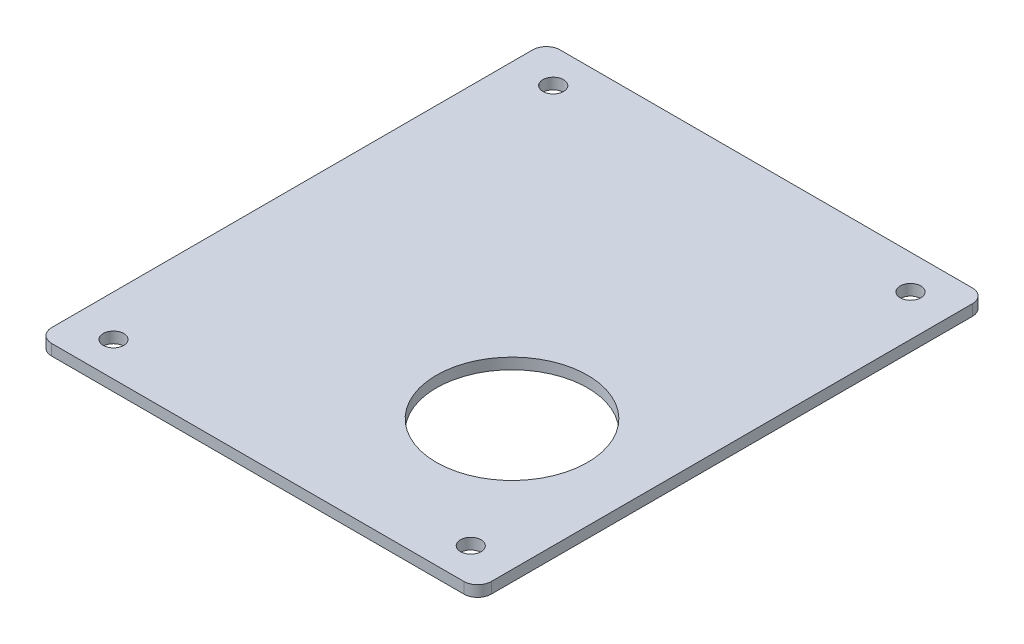
from build123d import *

# Parameters (mm, degrees)
SKETCH_1_W      = 64
SKETCH_1_H      = 74
SKETCH_1_R      = 1.5
SKETCH_1_R_2    = 11
EXTRUDE_1_DEPTH = 1.6
FILLET_1_R      = 2


with BuildPart() as part:
    # 草图1 → 凸台-拉伸1 (new body)
    with BuildSketch(Plane(origin=(0, 0, 0), x_dir=(1, 0, 0), z_dir=(0, 1, 0))):
        Rectangle(SKETCH_1_W, SKETCH_1_H)
        with Locations(Location((26, 32, 0), (0, 0, 270))):
            Circle(SKETCH_1_R, mode=Mode.SUBTRACT)
        with Locations(Location((-26, 32, 0), (0, 0, 90))):
            Circle(SKETCH_1_R, mode=Mode.SUBTRACT)
        with Locations(Location((13, -13, 0), (0, 0, 270))):
            Circle(SKETCH_1_R_2, mode=Mode.SUBTRACT)
        with Locations(Location((26, -32, 0), (0, 0, 90))):
            Circle(SKETCH_1_R, mode=Mode.SUBTRACT)
        with Locations(Location((-26, -32, 0), (0, 0, 270))):
            Circle(SKETCH_1_R, mode=Mode.SUBTRACT)
    extrude(amount=EXTRUDE_1_DEPTH)

    # 圆角1
    fillet_1_edges = [part.edges().sort_by_distance(p)[0] for p in [
        (32, 0.8, 37),
        (-32, 0.8, 37),
        (-32, 0.8, -37),
        (32, 0.8, -37),
    ]]
    fillet(fillet_1_edges, radius=FILLET_1_R)


solid = part.part
